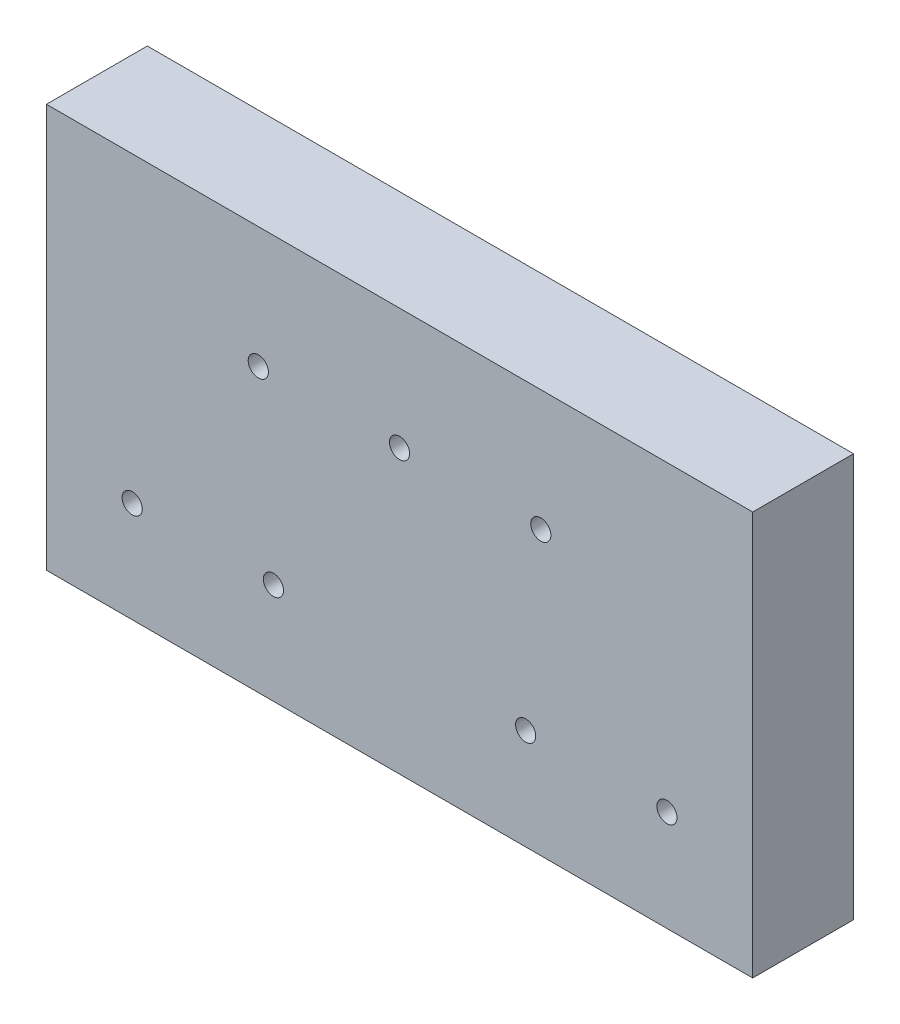
from build123d import *

# Parameters (mm, degrees)
SKETCH1_W           = 70
SKETCH1_H           = 40
SKETCH1_R           = 1
BOSS_EXTRUDE1_DEPTH = 10


with BuildPart() as part:
    # Sketch1 → Boss-Extrude1 (new body)
    with BuildSketch(Plane.XY):
        Rectangle(SKETCH1_W, SKETCH1_H)
        with Locations((-14, 8)):
            Circle(SKETCH1_R, mode=Mode.SUBTRACT)
        with Locations(Location((14, 8, 0), (0, 0, 180))):
            Circle(SKETCH1_R, mode=Mode.SUBTRACT)
        with Locations((0, 8)):
            Circle(SKETCH1_R, mode=Mode.SUBTRACT)
        with Locations((-26.5, -10)):
            Circle(SKETCH1_R, mode=Mode.SUBTRACT)
        with Locations((-12.5, -10)):
            Circle(SKETCH1_R, mode=Mode.SUBTRACT)
        with Locations(Location((26.5, -10, 0), (0, 0, 180))):
            Circle(SKETCH1_R, mode=Mode.SUBTRACT)
        with Locations(Location((12.5, -10, 0), (0, 0, 180))):
            Circle(SKETCH1_R, mode=Mode.SUBTRACT)
    extrude(amount=BOSS_EXTRUDE1_DEPTH)


solid = part.part
